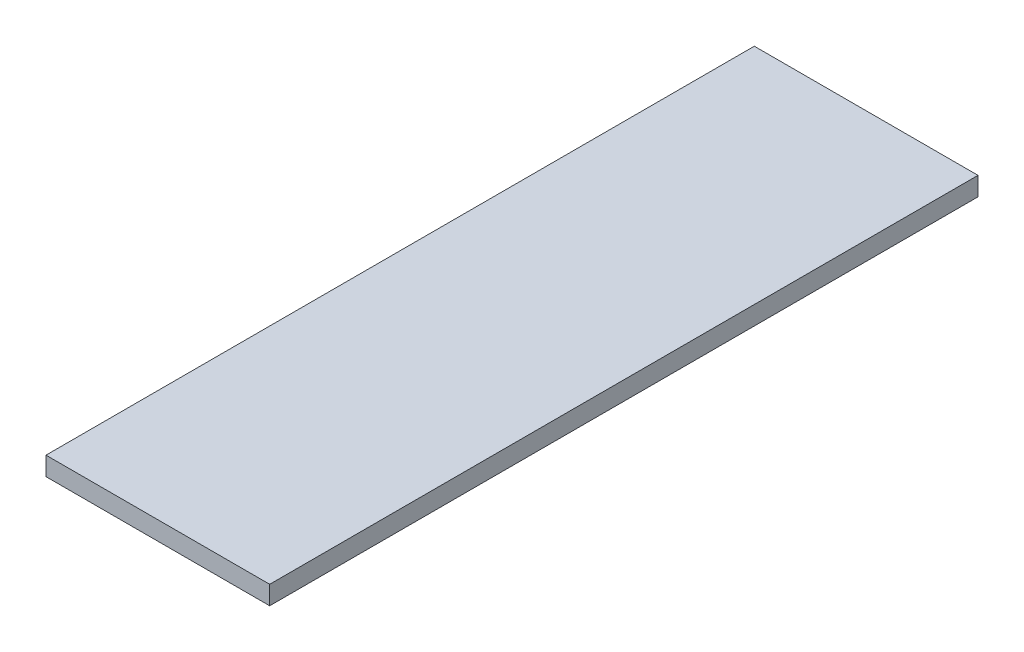
from build123d import *

# Parameters (mm, degrees)
SKETCH_1_W      = 18
SKETCH_1_H      = 57
EXTRUDE_1_DEPTH = 1.5


with BuildPart() as part:
    # 草图1 → 凸台-拉伸1 (new body)
    with BuildSketch(Plane(origin=(0, 0, 0), x_dir=(1, 0, 0), z_dir=(0, 1, 0))):
        Rectangle(SKETCH_1_W, SKETCH_1_H)
    extrude(amount=EXTRUDE_1_DEPTH)


solid = part.part
